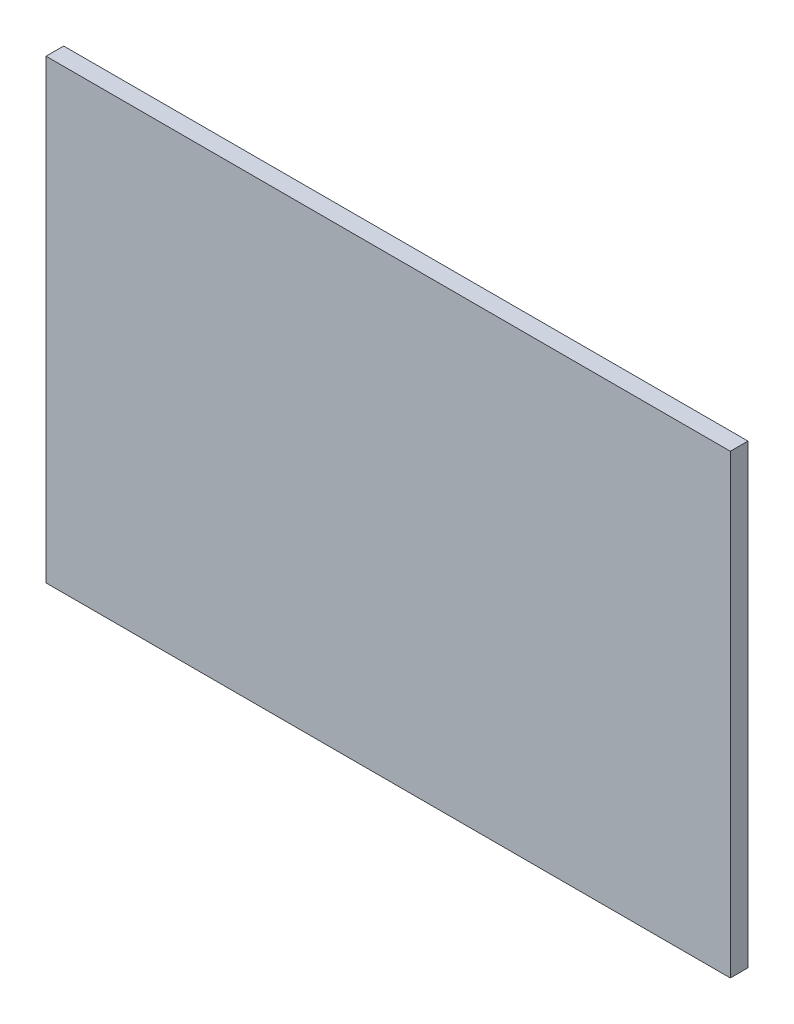
from build123d import *

# Parameters (mm, degrees)
SKETCH1_W           = 90
SKETCH1_H           = 60
BOSS_EXTRUDE1_DEPTH = 2.32


with BuildPart() as part:
    # Sketch1 → Boss-Extrude1 (new body)
    with BuildSketch(Plane.XY):
        Rectangle(SKETCH1_W, SKETCH1_H)
    extrude(amount=BOSS_EXTRUDE1_DEPTH)


solid = part.part
